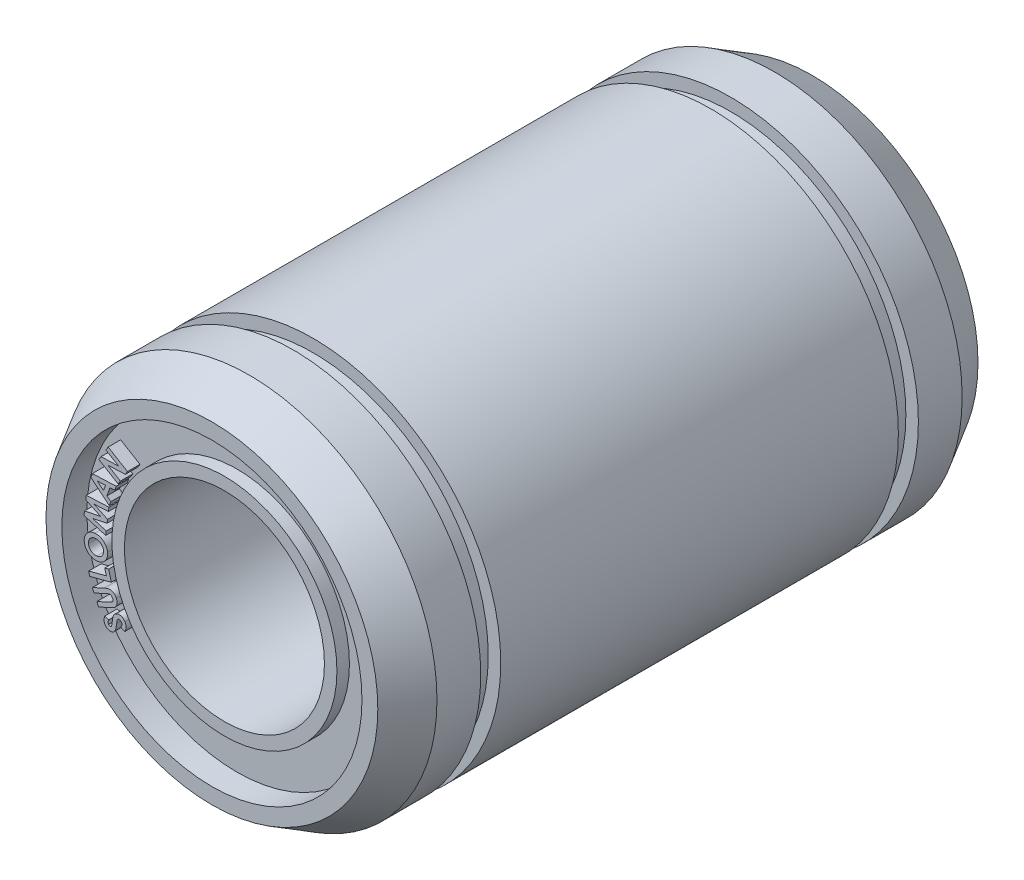
from build123d import *

# Parameters (mm, degrees)
SKETCH1_R                = 7.5
SKETCH1_R_2              = 6
BOSS_EXTRUDE1_DEPTH      = 12
CHAMFER2_SIZE            = 1.5
CHAMFER2_SIZE2           = 0.866025404
BOSS_EXTRUDE2_DEPTH      = 11
BOSS_EXTRUDE2_DEPTH_BACK = 11
SKETCH5_R                = 6
SKETCH5_R_2              = 4
SKETCH6_R                = 4.5
SKETCH6_R_2              = 4
BOSS_EXTRUDE3_DEPTH      = 0.5
SKETCH7_W                = 0.8
SKETCH7_H                = 0.5
BOSS_EXTRUDE4_DEPTH      = 0.5
CHAMFER3_SIZE            = 1.5
CHAMFER3_SIZE2           = 0.866025404


with BuildPart() as part:
    # Sketch1 → Boss-Extrude1 (new, symmetric)
    with BuildSketch(Plane.XY):
        Circle(SKETCH1_R)
        Circle(SKETCH1_R_2, mode=Mode.SUBTRACT)
    extrude(amount=BOSS_EXTRUDE1_DEPTH, both=True)

    # Chamfer2
    chamfer2_edges = [part.edges().sort_by_distance(p)[0] for p in [
        (-7.5, 0, 12),
    ]]
    chamfer2_side = [part.faces().sort_by_distance(p)[0] for p in [
        (-7.5, 0, 0),
    ]]
    chamfer(chamfer2_edges, length=CHAMFER2_SIZE, length2=CHAMFER2_SIZE2, reference=chamfer2_side[0])



with BuildPart() as body_2:
    # Sketch5 → Boss-Extrude2 (new, two sides: drawn at the far end of the back side and taken through both)
    with BuildSketch(Plane.XY.offset(-BOSS_EXTRUDE2_DEPTH_BACK)):
        Circle(SKETCH5_R)
        Circle(SKETCH5_R_2, mode=Mode.SUBTRACT)
    extrude(amount=BOSS_EXTRUDE2_DEPTH + BOSS_EXTRUDE2_DEPTH_BACK)


with BuildPart() as part_1:
    add(part.part)

    add(body_2.part)  # Boss-Extrude3 merges body 2
    # Sketch6 → Boss-Extrude3 (add)
    with BuildSketch(Plane.XY.offset(11)):
        Circle(SKETCH6_R)
        Circle(SKETCH6_R_2, mode=Mode.SUBTRACT)
    boss_extrude3 = extrude(amount=BOSS_EXTRUDE3_DEPTH)

    # Mirror1: Boss-Extrude3 across plane
    add(boss_extrude3.mirror(Plane.XY))

    # Sketch7 → Cut-Revolve1 (revolve, cut)
    with BuildSketch(Plane(origin=(0, 0, 0), x_dir=(0, 0, -1), z_dir=(1, 0, 0)), mode=Mode.PRIVATE) as cut_revolve1_sk:
        with Locations((-8.35, 7.25)):
            Rectangle(SKETCH7_W, SKETCH7_H)
        with Locations((8.35, 7.25)):
            Rectangle(SKETCH7_W, SKETCH7_H)
    revolve(cut_revolve1_sk.sketch.rotate(Axis((0, 0, 0), (0, 0, -1)), 90), axis=Axis((0, 0, 0), (0, 0, -1)), mode=Mode.SUBTRACT)

    # Sketch8 → Boss-Extrude4 (add)
    # profile 1 of 7: a face of its own
    with BuildSketch(Plane.XY.offset(11)):
        Polygon((-5.019213926, 2.56696334), (-4.934838926, 2.707408052), (-4.229009599, 2.73336959), (-4.736161041, 3.03805709), (-4.647819695, 3.184811898), (-3.877086522, 2.72165084), (-3.961822099, 2.580665263), (-4.666028829, 2.554523436), (-4.160319695, 2.25055709), (-4.248480752, 2.103802283), align=None)
    # profile 2 of 7: a face of its own
    with BuildSketch(Plane.XY.offset(11)):
        Polygon((-5.335912282, 1.78586355), (-5.281104589, 1.949024608), (-4.326296897, 1.9897698), (-4.382546897, 1.822462108), (-4.578881032, 1.815070281), (-4.694986801, 1.470178454), (-4.54390507, 1.342714512), (-4.600335359, 1.175406819), align=None)
        Polygon((-5.084049301, 1.793255377), (-4.831645455, 1.582858742), (-4.756104589, 1.807498166), align=None, mode=Mode.SUBTRACT)
    # profile 3 of 7: a face of its own
    with BuildSketch(Plane.XY.offset(11)):
        Polygon((-5.614467681, 0.334474611), (-5.594455662, 0.499618842), (-4.951006143, 0.629787111), (-5.544515758, 0.912479419), (-5.524684028, 1.0752799), (-4.619816239, 1.1174674), (-4.639467681, 0.954666919), (-5.210982104, 0.927263073), (-4.673902778, 0.670892881), (-4.691931624, 0.521974611), (-5.274443643, 0.403344804), (-4.726186431, 0.23856115), (-4.746018162, 0.073957785), align=None)
    # profile 4 of 7: a face of its own
    with BuildSketch(Plane.XY.offset(11)):
        with BuildLine():
            add(Edge.make_bspline(
                [(-5.603687751, -0.569841462), (-5.604771213, -0.554405134), (-5.606912505, -0.523897658), (-5.604836323, -0.478508597), (-5.59828654, -0.434375331), (-5.587500583, -0.391434334), (-5.572018329, -0.349792704), (-5.552227666, -0.309321337), (-5.527970554, -0.270163036), (-5.499603183, -0.232735486), (-5.46801183, -0.197899174), (-5.433869548, -0.166445264), (-5.39720005, -0.139279288), (-5.358297061, -0.116022804), (-5.316953038, -0.097101922), (-5.27344981, -0.082048667), (-5.227654972, -0.071116249), (-5.196164785, -0.067200484), (-5.180190155, -0.065214058)],
                knots=[0, 0, 0, 0, 1.013293411, 2.002615178, 2.969929983, 3.932617152, 4.898167076, 5.875568108, 6.879846568, 7.911542323, 8.948552327, 9.957490501, 10.948237499, 11.933530897, 12.921966733, 13.921943731, 14.945824639, 16, 16, 16, 16], degree=3))
            add(Edge.make_bspline(
                [(-5.180190155, -0.065214058), (-5.164273478, -0.064064367), (-5.132930459, -0.061800403), (-5.086362342, -0.063759752), (-5.04126119, -0.069851147), (-4.997576001, -0.080239792), (-4.955530926, -0.095487507), (-4.914737099, -0.114512303), (-4.875636997, -0.138461127), (-4.838306799, -0.166172433), (-4.803561242, -0.197027873), (-4.772554477, -0.230566202), (-4.745498007, -0.266182305), (-4.722630215, -0.304154469), (-4.703816933, -0.344353118), (-4.689061103, -0.386768614), (-4.677976192, -0.431298182), (-4.674221861, -0.46197409), (-4.672317559, -0.47753377)],
                knots=[0, 0, 0, 0, 1.051083948, 2.069787806, 3.065186475, 4.047001297, 5.02295037, 6.008083167, 7.00866935, 8.039292488, 9.068841912, 10.066672639, 11.045005907, 12.011619095, 12.982628744, 13.964723154, 14.967650608, 16, 16, 16, 16], degree=3))
            add(Edge.make_bspline(
                [(-4.672317559, -0.47753377), (-4.671174586, -0.493870455), (-4.668931316, -0.525933852), (-4.670769912, -0.573546861), (-4.677277083, -0.619372172), (-4.688096233, -0.663651894), (-4.703679977, -0.706136439), (-4.723860037, -0.746959035), (-4.748544058, -0.786081785), (-4.777419269, -0.823037218), (-4.80937336, -0.857226715), (-4.843868735, -0.887740214), (-4.88035879, -0.914362069), (-4.918952156, -0.936996103), (-4.959495616, -0.955734288), (-5.002160222, -0.970036057), (-5.046713009, -0.980983345), (-5.077372214, -0.984754616), (-5.092930539, -0.986668385)],
                knots=[0, 0, 0, 0, 1.067921877, 2.095970056, 3.101855708, 4.083271722, 5.064468398, 6.04820796, 7.049037107, 8.077279679, 9.103666541, 10.098115712, 11.077681476, 12.046047685, 13.012753385, 13.986115716, 14.978033957, 16, 16, 16, 16], degree=3))
            add(Edge.make_bspline(
                [(-5.092930539, -0.986668385), (-5.103440225, -0.987549711), (-5.124315146, -0.989300249), (-5.155518994, -0.989084084), (-5.186291796, -0.98739402), (-5.216584291, -0.983569235), (-5.246438089, -0.977877368), (-5.27570031, -0.969780851), (-5.304639777, -0.96008789), (-5.333006568, -0.948400159), (-5.360531237, -0.934916184), (-5.386927267, -0.919758882), (-5.411982678, -0.90293231), (-5.435907526, -0.8847182), (-5.458469147, -0.864750233), (-5.479995132, -0.84338628), (-5.499940642, -0.820123157), (-5.518906818, -0.795761388), (-5.536062918, -0.770115503), (-5.551506137, -0.743637034), (-5.565063126, -0.716437945), (-5.576530972, -0.688431306), (-5.586401303, -0.659880537), (-5.594084129, -0.630511219), (-5.600166523, -0.600485556), (-5.60251129, -0.580079819), (-5.603687751, -0.569841462)],
                knots=[0, 0, 0, 0, 1.035459586, 2.056687238, 3.061940431, 4.061370555, 5.053522074, 6.044461155, 7.041290387, 8.049813999, 9.055656306, 10.04996546, 11.037205352, 12.018337724, 13.001244298, 13.994676931, 14.994804129, 16.009047072, 17.025760685, 18.023026782, 19.018281714, 20.008182895, 20.993833169, 21.983241407, 22.988113225, 24, 24, 24, 24], degree=3))
        make_face()
        with BuildLine():
            add(Edge.make_bspline(
                [(-5.438363232, -0.555418385), (-5.437109991, -0.56542628), (-5.434635251, -0.585188591), (-5.427702433, -0.613871064), (-5.418345203, -0.641069143), (-5.406333875, -0.666765442), (-5.391693108, -0.690881294), (-5.374628984, -0.713670472), (-5.354831507, -0.73477848), (-5.332804641, -0.754270174), (-5.309004915, -0.771782064), (-5.283518565, -0.786370216), (-5.257066622, -0.798642664), (-5.229157567, -0.807540183), (-5.200229098, -0.814186762), (-5.17001231, -0.817634244), (-5.138634587, -0.8186527), (-5.117443874, -0.817092034), (-5.106632462, -0.816295789)],
                knots=[0, 0, 0, 0, 1.025341516, 2.024713326, 2.995229938, 3.946946593, 4.904144855, 5.86024931, 6.837787205, 7.84247362, 8.848795365, 9.837565654, 10.825144666, 11.809141188, 12.811705142, 13.839903807, 14.897928127, 16, 16, 16, 16], degree=3))
            add(Edge.make_bspline(
                [(-5.106632462, -0.816295789), (-5.094688186, -0.814876318), (-5.071357327, -0.812103652), (-5.037791139, -0.803591024), (-5.006435982, -0.79230769), (-4.97728422, -0.777790978), (-4.950457703, -0.759978865), (-4.925825447, -0.739127438), (-4.903370801, -0.715235806), (-4.890736526, -0.697230872), (-4.884336789, -0.688110693)],
                knots=[0, 0, 0, 0, 1.084699738, 2.118753527, 3.117445896, 4.087776396, 5.050618586, 6.016709792, 6.995388641, 8, 8, 8, 8], degree=3))
            add(Edge.make_bspline(
                [(-4.884336789, -0.688110693), (-4.879633984, -0.680737899), (-4.87030368, -0.666110374), (-4.858832239, -0.643017012), (-4.849614103, -0.619390583), (-4.842285505, -0.595305786), (-4.83729953, -0.570611441), (-4.834330005, -0.545346552), (-4.833832575, -0.519573391), (-4.835047054, -0.502287849), (-4.835658905, -0.493579443)],
                knots=[0, 0, 0, 0, 1.0250378, 2.03366143, 3.017882375, 3.996738852, 4.982271152, 5.968408103, 6.976489846, 8, 8, 8, 8], degree=3))
            add(Edge.make_bspline(
                [(-4.835658905, -0.493579443), (-4.836906654, -0.483749988), (-4.839363019, -0.464399361), (-4.84634976, -0.436327726), (-4.855726822, -0.40959654), (-4.867830046, -0.384235765), (-4.882745446, -0.360417589), (-4.899997546, -0.337834817), (-4.919916871, -0.316674105), (-4.942360253, -0.297249768), (-4.966398736, -0.27966293), (-4.991804807, -0.264820492), (-5.018151751, -0.252584925), (-5.045580114, -0.243199032), (-5.074056147, -0.236719433), (-5.103450437, -0.232969313), (-5.133885289, -0.231742621), (-5.154415335, -0.233334196), (-5.164865636, -0.234144347)],
                knots=[0, 0, 0, 0, 1.017887162, 2.003850259, 2.967177827, 3.926057472, 4.886110667, 5.851180024, 6.843317752, 7.867950975, 8.898582717, 9.900958706, 10.887792445, 11.880295583, 12.875429553, 13.88465529, 14.923237292, 16, 16, 16, 16], degree=3))
            add(Edge.make_bspline(
                [(-5.164865636, -0.234144347), (-5.175177538, -0.235378278), (-5.195556346, -0.237816824), (-5.225083961, -0.245034804), (-5.253250277, -0.254364368), (-5.279929347, -0.266311679), (-5.305069751, -0.280944867), (-5.328571474, -0.298307051), (-5.350953649, -0.317737921), (-5.371205801, -0.339857601), (-5.389570042, -0.363408286), (-5.405114325, -0.388281309), (-5.418110238, -0.413903596), (-5.427789943, -0.440644009), (-5.43493097, -0.468100528), (-5.438973689, -0.496508494), (-5.440644379, -0.525747181), (-5.439129834, -0.545447083), (-5.438363232, -0.555418385)],
                knots=[0, 0, 0, 0, 1.060114784, 2.095042534, 3.098761831, 4.088032384, 5.075720515, 6.064228771, 7.069149004, 8.098745803, 9.122891904, 10.115965163, 11.090650134, 12.052097306, 13.015502621, 13.983591319, 14.979374611, 16, 16, 16, 16], degree=3))
        make_face(mode=Mode.SUBTRACT)
    # profile 5 of 7: a face of its own
    with BuildSketch(Plane.XY.offset(11)):
        Polygon((-5.383854115, -1.663157535), (-5.427303634, -1.499095035), (-4.721834884, -1.312496478), (-4.784935845, -1.073433978), (-4.628445461, -1.03214792), (-4.52189498, -1.43527292), align=None)
    # profile 6 of 7: a face of its own
    with BuildSketch(Plane.XY.offset(11)):
        with BuildLine():
            Line((-5.029590563, -2.546195895), (-5.100443928, -2.391147818))
            Line((-5.100443928, -2.391147818), (-4.574722774, -2.150462722))
            add(Edge.make_bspline(
                [(-4.574722774, -2.150462722), (-4.569289345, -2.14798951), (-4.558815687, -2.143222064), (-4.544090686, -2.135519821), (-4.530538579, -2.128410599), (-4.518464239, -2.121442429), (-4.507915492, -2.114515858), (-4.498709107, -2.107843794), (-4.490730338, -2.101500307), (-4.482300342, -2.0929924), (-4.473670766, -2.081933851), (-4.465519588, -2.067443444), (-4.459986373, -2.051630492), (-4.456716618, -2.034751077), (-4.455995341, -2.016996539), (-4.458107291, -1.998623412), (-4.462731902, -1.979697891), (-4.467987538, -1.967464842), (-4.470696332, -1.961159838)],
                knots=[0, 0, 0, 0, 1.148435637, 2.213762344, 3.196639077, 4.093071106, 4.894864287, 5.623441161, 6.280820129, 6.853172085, 7.924131837, 8.969759653, 10.037718811, 11.13305885, 12.267201454, 13.441996364, 14.681586003, 16, 16, 16, 16], degree=3))
            add(Edge.make_bspline(
                [(-4.470696332, -1.961159838), (-4.473890538, -1.95469186), (-4.480123247, -1.942071191), (-4.492098763, -1.925246038), (-4.505810309, -1.910872592), (-4.521146625, -1.899303698), (-4.537241816, -1.889955077), (-4.554057683, -1.883841791), (-4.570990888, -1.880226525), (-4.585535255, -1.879900735), (-4.59784385, -1.88147979), (-4.608665652, -1.883394285), (-4.620897398, -1.88679119), (-4.634696832, -1.89110109), (-4.649886807, -1.896802704), (-4.666740523, -1.903203935), (-4.684899778, -1.911038549), (-4.697448724, -1.916727989), (-4.703989601, -1.919693491)],
                knots=[0, 0, 0, 0, 1.260702351, 2.459950721, 3.597876305, 4.723146205, 5.810989002, 6.842423124, 7.840620339, 8.829355756, 9.369374735, 10.01085573, 10.750578187, 11.588703975, 12.540162428, 13.588874705, 14.743251218, 16, 16, 16, 16], degree=3))
            Line((-4.703989601, -1.919693491), (-5.210239601, -2.151364164))
            Line((-5.210239601, -2.151364164), (-5.281092966, -1.996316088))
            Line((-5.281092966, -1.996316088), (-4.796838159, -1.774741568))
            add(Edge.make_bspline(
                [(-4.796838159, -1.774741568), (-4.787002199, -1.770249768), (-4.768128833, -1.761630844), (-4.740677324, -1.749947873), (-4.715400016, -1.739603126), (-4.692278559, -1.730757846), (-4.671277581, -1.723537479), (-4.652512807, -1.717611222), (-4.635814656, -1.713492866), (-4.616343886, -1.70975109), (-4.592843087, -1.707807506), (-4.564301657, -1.709017842), (-4.534741135, -1.713382083), (-4.504723222, -1.721175851), (-4.475068978, -1.731520901), (-4.447124313, -1.745057493), (-4.421529611, -1.761689769), (-4.397828861, -1.780907568), (-4.376210682, -1.803344675), (-4.356570675, -1.829023034), (-4.338324758, -1.857779444), (-4.328235933, -1.878773275), (-4.323040082, -1.889585318)],
                knots=[0, 0, 0, 0, 1.156467227, 2.219044284, 3.19063233, 4.077593984, 4.866278595, 5.565676642, 6.181452405, 6.704620806, 7.685182106, 8.695051312, 9.754045282, 10.874919227, 12.007289428, 13.108286134, 14.186935546, 15.265086923, 16.365126346, 17.510645842, 18.717956423, 20, 20, 20, 20], degree=3))
            add(Edge.make_bspline(
                [(-4.323040082, -1.889585318), (-4.319801328, -1.896871672), (-4.313434639, -1.911195066), (-4.305953035, -1.933203542), (-4.299750607, -1.954962501), (-4.295207261, -1.976652085), (-4.292385042, -1.998169052), (-4.290778888, -2.019549108), (-4.291283555, -2.040824036), (-4.293001205, -2.061854624), (-4.296324324, -2.082301885), (-4.300584096, -2.102084919), (-4.306191241, -2.120920755), (-4.312821006, -2.139016438), (-4.321041422, -2.156007237), (-4.329987345, -2.172392), (-4.340326118, -2.187761082), (-4.352126497, -2.202486529), (-4.365896988, -2.217076315), (-4.382697228, -2.23143878), (-4.402398465, -2.246142353), (-4.425048855, -2.261363324), (-4.450835444, -2.276714937), (-4.479570666, -2.292596523), (-4.511280755, -2.308851729), (-4.533698655, -2.319232653), (-4.545335755, -2.324621376)],
                knots=[0, 0, 0, 0, 1.021687439, 2.008416554, 2.976688021, 3.921003407, 4.846015211, 5.757160507, 6.666349574, 7.570990458, 8.460113649, 9.319951496, 10.163377453, 10.977587415, 11.787412014, 12.580575583, 13.369010973, 14.15827396, 14.99746724, 15.936709606, 16.987520732, 18.147742274, 19.433275887, 20.833286212, 22.356163382, 24, 24, 24, 24], degree=3))
            Line((-4.545335755, -2.324621376), (-5.029590563, -2.546195895))
        make_face()
    # profile 7 of 7: a face of its own
    with BuildSketch(Plane.XY.offset(11)):
        with BuildLine():
            Line((-4.787625882, -2.738342648), (-4.626808575, -2.785037359))
            add(Edge.make_bspline(
                [(-4.626808575, -2.785037359), (-4.630039746, -2.793532567), (-4.636232402, -2.809813939), (-4.64347801, -2.833912043), (-4.647777727, -2.856649193), (-4.649858399, -2.877890845), (-4.649719139, -2.897731914), (-4.646561965, -2.916038457), (-4.64127534, -2.93306829), (-4.635586786, -2.943173498), (-4.632758094, -2.948198417)],
                knots=[0, 0, 0, 0, 1.287646441, 2.467820929, 3.559995072, 4.560638573, 5.488925283, 6.361033311, 7.185006807, 8, 8, 8, 8], degree=3))
            add(Edge.make_bspline(
                [(-4.632758094, -2.948198417), (-4.62969369, -2.952559671), (-4.623792319, -2.960958489), (-4.613215622, -2.971687116), (-4.601362692, -2.979713783), (-4.588725544, -2.985116997), (-4.576059039, -2.988014657), (-4.563988161, -2.988488022), (-4.55270236, -2.986423754), (-4.546210831, -2.982932027), (-4.54297444, -2.981191205)],
                knots=[0, 0, 0, 0, 1.209333939, 2.328912064, 3.400275986, 4.439778179, 5.433183311, 6.334452776, 7.169631329, 8, 8, 8, 8], degree=3))
            add(Edge.make_bspline(
                [(-4.54297444, -2.981191205), (-4.539931765, -2.979080792), (-4.533802346, -2.974829399), (-4.526330581, -2.966310157), (-4.519811242, -2.956663669), (-4.516771723, -2.949404263), (-4.515210017, -2.945674378)],
                knots=[0, 0, 0, 0, 0.965706043, 1.94539934, 2.94434582, 4, 4, 4, 4], degree=3))
            add(Edge.make_bspline(
                [(-4.515210017, -2.945674378), (-4.514147421, -2.94250127), (-4.511686487, -2.935152464), (-4.508626269, -2.922343641), (-4.50514618, -2.906365992), (-4.501689771, -2.887150605), (-4.497638974, -2.864759776), (-4.493548222, -2.839146511), (-4.489215751, -2.81029991), (-4.486402262, -2.789968381), (-4.484921555, -2.779268128)],
                knots=[0, 0, 0, 0, 0.474147896, 1.09810967, 1.865028906, 2.792315478, 3.86513017, 5.090549847, 6.468789568, 8, 8, 8, 8], degree=3))
            add(Edge.make_bspline(
                [(-4.484921555, -2.779268128), (-4.483543698, -2.769291569), (-4.480928684, -2.750357218), (-4.477150431, -2.72349295), (-4.473709848, -2.699697127), (-4.470704208, -2.678885147), (-4.467800185, -2.661107889), (-4.465288031, -2.646322082), (-4.463179715, -2.634590412), (-4.461737628, -2.627823196), (-4.461123479, -2.624941205)],
                knots=[0, 0, 0, 0, 1.547656545, 2.937272422, 4.168857191, 5.242424632, 6.168553879, 6.936782392, 7.547201889, 8, 8, 8, 8], degree=3))
            add(Edge.make_bspline(
                [(-4.461123479, -2.624941205), (-4.458298319, -2.613592032), (-4.452873573, -2.591799853), (-4.442220097, -2.561289002), (-4.430123243, -2.534190823), (-4.416532304, -2.5100363), (-4.400526884, -2.48871582), (-4.382514412, -2.469211495), (-4.362143587, -2.451470655), (-4.347055137, -2.441313209), (-4.339428767, -2.436179186)],
                knots=[0, 0, 0, 0, 1.214063191, 2.331190279, 3.350760311, 4.292816532, 5.202738135, 6.112488508, 7.045968226, 8, 8, 8, 8], degree=3))
            add(Edge.make_bspline(
                [(-4.339428767, -2.436179186), (-4.331765282, -2.431566124), (-4.316698264, -2.422496479), (-4.292869746, -2.411920052), (-4.268935023, -2.403732464), (-4.244704284, -2.398214404), (-4.220210568, -2.395567277), (-4.195437121, -2.395339125), (-4.170408316, -2.397896218), (-4.145458135, -2.40322905), (-4.120795223, -2.410632429), (-4.097110067, -2.42086665), (-4.074421714, -2.4332733), (-4.053088434, -2.448425069), (-4.032815468, -2.465811125), (-4.013635442, -2.48560396), (-3.995532081, -2.507765105), (-3.984841243, -2.523999272), (-3.979392709, -2.532272936)],
                knots=[0, 0, 0, 0, 1.026385115, 2.017954532, 2.986978708, 3.927947565, 4.865391754, 5.810930593, 6.768234365, 7.748207209, 8.737155171, 9.720403376, 10.705804938, 11.701473004, 12.719540757, 13.768872892, 14.862917019, 16, 16, 16, 16], degree=3))
            add(Edge.make_bspline(
                [(-3.979392709, -2.532272936), (-3.975335985, -2.538952031), (-3.967329814, -2.552133597), (-3.957064358, -2.572494822), (-3.948562385, -2.593078158), (-3.941441548, -2.613687431), (-3.936325653, -2.634537339), (-3.932346018, -2.655396193), (-3.930464316, -2.676463277), (-3.930092306, -2.697671677), (-3.931312542, -2.719085231), (-3.934526669, -2.740808474), (-3.939068368, -2.762986114), (-3.945932471, -2.785377069), (-3.954242987, -2.808122109), (-3.964143884, -2.831309439), (-3.976115677, -2.854701333), (-3.985090766, -2.870173513), (-3.989669152, -2.878066205)],
                knots=[0, 0, 0, 0, 1.02160864, 2.016201527, 2.977964644, 3.932250132, 4.864272877, 5.782947909, 6.706450342, 7.626032442, 8.554968956, 9.507408284, 10.495366222, 11.512279178, 12.566377024, 13.661197181, 14.806926365, 16, 16, 16, 16], degree=3))
            Line((-3.989669152, -2.878066205), (-4.138587421, -2.803607071))
            add(Edge.make_bspline(
                [(-4.138587421, -2.803607071), (-4.133582755, -2.794120167), (-4.124015159, -2.775983723), (-4.112417229, -2.748830444), (-4.104574859, -2.722946313), (-4.100083712, -2.698503155), (-4.0990417, -2.675478579), (-4.101522805, -2.653838261), (-4.107572116, -2.633551687), (-4.114322294, -2.621413092), (-4.117673959, -2.615385917)],
                knots=[0, 0, 0, 0, 1.294139108, 2.474050948, 3.55701427, 4.551437514, 5.4659571, 6.327740533, 7.16967329, 8, 8, 8, 8], degree=3))
            add(Edge.make_bspline(
                [(-4.117673959, -2.615385917), (-4.121691377, -2.609583258), (-4.129466434, -2.59835316), (-4.144006382, -2.584398133), (-4.160307907, -2.573666448), (-4.178043275, -2.566720909), (-4.195877507, -2.562515528), (-4.213205131, -2.562314793), (-4.229610565, -2.56561335), (-4.239227245, -2.570782876), (-4.244056171, -2.573378705)],
                knots=[0, 0, 0, 0, 1.147541826, 2.220879599, 3.261013292, 4.306479152, 5.309019566, 6.229449662, 7.110934592, 8, 8, 8, 8], degree=3))
            add(Edge.make_bspline(
                [(-4.244056171, -2.573378705), (-4.248208864, -2.576358894), (-4.256590621, -2.582374079), (-4.267152451, -2.594397336), (-4.276392611, -2.608502711), (-4.282586099, -2.622292125), (-4.287124428, -2.635033274), (-4.290185534, -2.646852154), (-4.293768302, -2.660420715), (-4.29662375, -2.676136667), (-4.300004924, -2.693699469), (-4.302929776, -2.713328725), (-4.306060093, -2.734894462), (-4.307963476, -2.74993771), (-4.308960017, -2.757813802)],
                knots=[0, 0, 0, 0, 0.910679941, 1.838107835, 2.83878883, 3.914970798, 4.529650626, 5.253867616, 6.095047352, 7.03635736, 8.10625351, 9.29081069, 10.58156821, 12, 12, 12, 12], degree=3))
            add(Edge.make_bspline(
                [(-4.308960017, -2.757813802), (-4.310812684, -2.772787344), (-4.314366538, -2.801510134), (-4.320603495, -2.842719534), (-4.326771342, -2.880322426), (-4.333411112, -2.914301646), (-4.340442989, -2.944593979), (-4.347547504, -2.97134736), (-4.355021185, -2.994505787), (-4.363071849, -3.014349791), (-4.371673121, -3.031786928), (-4.380585477, -3.047808743), (-4.390319652, -3.062657231), (-4.400916787, -3.076240393), (-4.411974689, -3.088915497), (-4.423986676, -3.100220374), (-4.436434696, -3.110725381), (-4.445435713, -3.116672828), (-4.449945594, -3.119652744)],
                knots=[0, 0, 0, 0, 1.804438292, 3.461338615, 4.984471496, 6.361666836, 7.60129831, 8.703234628, 9.671512468, 10.50972676, 11.261925021, 11.995661829, 12.70136834, 13.382829797, 14.0549403, 14.710749838, 15.354032529, 16, 16, 16, 16], degree=3))
            add(Edge.make_bspline(
                [(-4.449945594, -3.119652744), (-4.456484382, -3.123514053), (-4.46942205, -3.131154053), (-4.489866374, -3.140130029), (-4.510753734, -3.146909928), (-4.532164422, -3.151244571), (-4.554050445, -3.153237347), (-4.576395278, -3.152784923), (-4.599224145, -3.150277561), (-4.622263931, -3.1453797), (-4.645031358, -3.138513513), (-4.666694142, -3.129203128), (-4.687250574, -3.118162643), (-4.706598023, -3.105147757), (-4.724783791, -3.090051079), (-4.741636783, -3.072873982), (-4.757518598, -3.053904406), (-4.766722452, -3.040000212), (-4.771399921, -3.032933994)],
                knots=[0, 0, 0, 0, 0.982813431, 1.944597851, 2.884883073, 3.822135214, 4.767817035, 5.725308598, 6.712059204, 7.737882008, 8.771939761, 9.786808029, 10.786307958, 11.790132325, 12.801652171, 13.841872472, 14.903223031, 16, 16, 16, 16], degree=3))
            add(Edge.make_bspline(
                [(-4.771399921, -3.032933994), (-4.777007582, -3.023450382), (-4.788166327, -3.004578842), (-4.800293375, -2.973908669), (-4.80904981, -2.942063658), (-4.81313028, -2.914366124), (-4.814369578, -2.891237454), (-4.813905684, -2.872632028), (-4.812446195, -2.852959356), (-4.80990811, -2.832135447), (-4.8061329, -2.810230667), (-4.800950353, -2.787239061), (-4.79487905, -2.763113202), (-4.790085018, -2.74674093), (-4.787625882, -2.738342648)],
                knots=[0, 0, 0, 0, 1.29640846, 2.57973696, 3.871476734, 5.181293919, 5.869045044, 6.598506678, 7.372391716, 8.192697571, 9.06926154, 9.990121729, 10.969017476, 12, 12, 12, 12], degree=3))
        make_face()
    extrude(amount=BOSS_EXTRUDE4_DEPTH)

    # Chamfer3
    chamfer3_edges = [part_1.edges().sort_by_distance(p)[0] for p in [
        (-7.5, 0, -12),
    ]]
    chamfer3_side = [part_1.faces().sort_by_distance(p)[0] for p in [
        (-7.5, 0, -10.375),
    ]]
    chamfer(chamfer3_edges, length=CHAMFER3_SIZE, length2=CHAMFER3_SIZE2, reference=chamfer3_side[0])


solid = part_1.part
